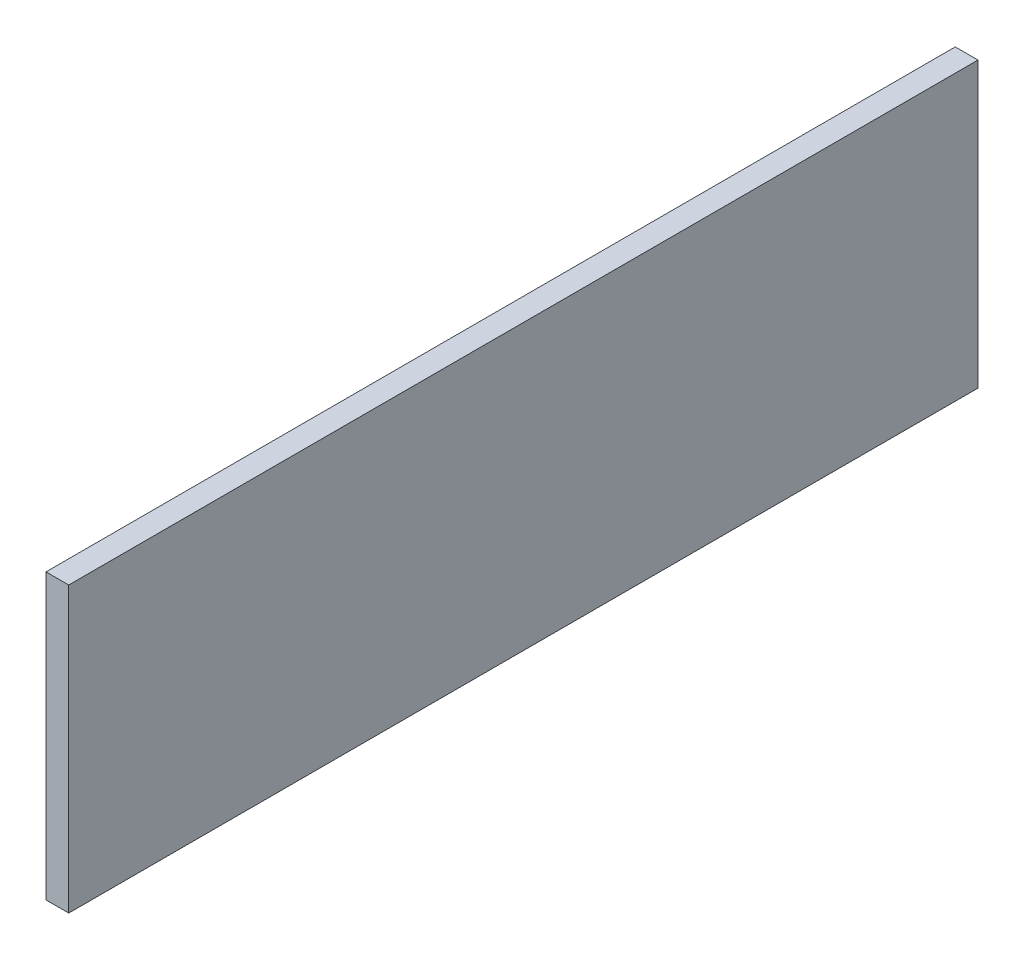
from build123d import *

# Parameters (mm, degrees)
SKETCH1_W           = 20
SKETCH1_H           = 250
BOSS_EXTRUDE1_DEPTH = 800


with BuildPart() as part:
    # Sketch1 → Boss-Extrude1 (new body)
    with BuildSketch(Plane.XY):
        Rectangle(SKETCH1_W, SKETCH1_H)
    extrude(amount=BOSS_EXTRUDE1_DEPTH)


solid = part.part
